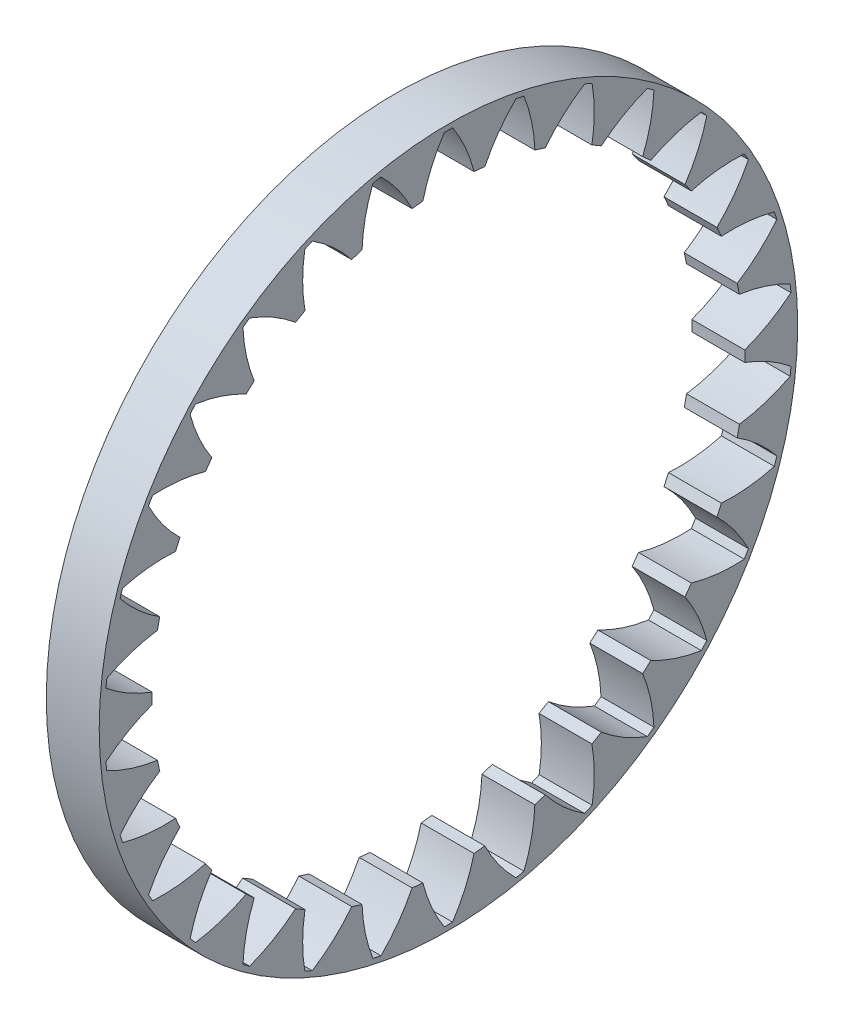
from build123d import *

# Parameters (mm, degrees)
BASPROSKE_W           = 5
BASPROSKE_H           = 7
TOOTHCUT_DEPTH        = 50.749371855
TEETHCUTS_COUNT       = 30
TEETHCUTS_ANGLE       = 348
CROQUIS1_OUTSIDE_W    = 91.824
CROQUIS1_OUTSIDE_H    = 91.824
CROQUIS1_OUTSIDE_R    = 33
CORTAR_EXTRUIR1_DEPTH = 50.749371855


with BuildPart() as part:
    # BasProSke → Base-Revolve (revolve)
    with BuildSketch(Plane(origin=(0, 0, 0), x_dir=(1, 0, 0), z_dir=(0, 1, 0)), mode=Mode.PRIVATE) as base_revolve_sk:
        with Locations((2.5, 31.5)):
            Rectangle(BASPROSKE_W, BASPROSKE_H)
    revolve(base_revolve_sk.sketch.rotate(Axis((-10, 0, 0), (1, 0, 0)), 180), axis=Axis((-10, 0, 0), (1, 0, 0)))

    # TooCutSke → ToothCut (cut, through all)
    with BuildSketch(Plane(origin=(0, 0, 0), x_dir=(0, 0, -1), z_dir=(1, 0, 0))):
        with BuildLine():
            ThreePointArc((2.421581378, 27.869592548), (1.601037152, 30.270461464), (0.387584664, 32.498688883))
            ThreePointArc((0.387584664, 32.498688883), (0, 32.501), (-0.387584664, 32.498688883))
            ThreePointArc((-0.387584664, 32.498688883), (-1.601037152, 30.270461464), (-2.421581378, 27.869592548))
            ThreePointArc((-2.421581378, 27.869592548), (0, 27.9746), (2.421581378, 27.869592548))
        make_face()
    toothcut = extrude(amount=TOOTHCUT_DEPTH, mode=Mode.SUBTRACT)

    # TeethCuts: ToothCut ×30 about axis
    teethcuts_axis = Axis((-10, 0, 0), (1, 0, 0))
    for i in range(1, TEETHCUTS_COUNT):
        add(toothcut.rotate(teethcuts_axis, i * TEETHCUTS_ANGLE / (TEETHCUTS_COUNT - 1)), mode=Mode.SUBTRACT)

    # Croquis1 outside → Cortar-Extruir1 (cut, through all)
    with BuildSketch(Plane(origin=(5, 0, 0), x_dir=(0, 0, -1), z_dir=(1, 0, 0))):
        Rectangle(CROQUIS1_OUTSIDE_W, CROQUIS1_OUTSIDE_H)
        Circle(CROQUIS1_OUTSIDE_R, mode=Mode.SUBTRACT)
    extrude(amount=-CORTAR_EXTRUIR1_DEPTH, mode=Mode.SUBTRACT)


solid = part.part
